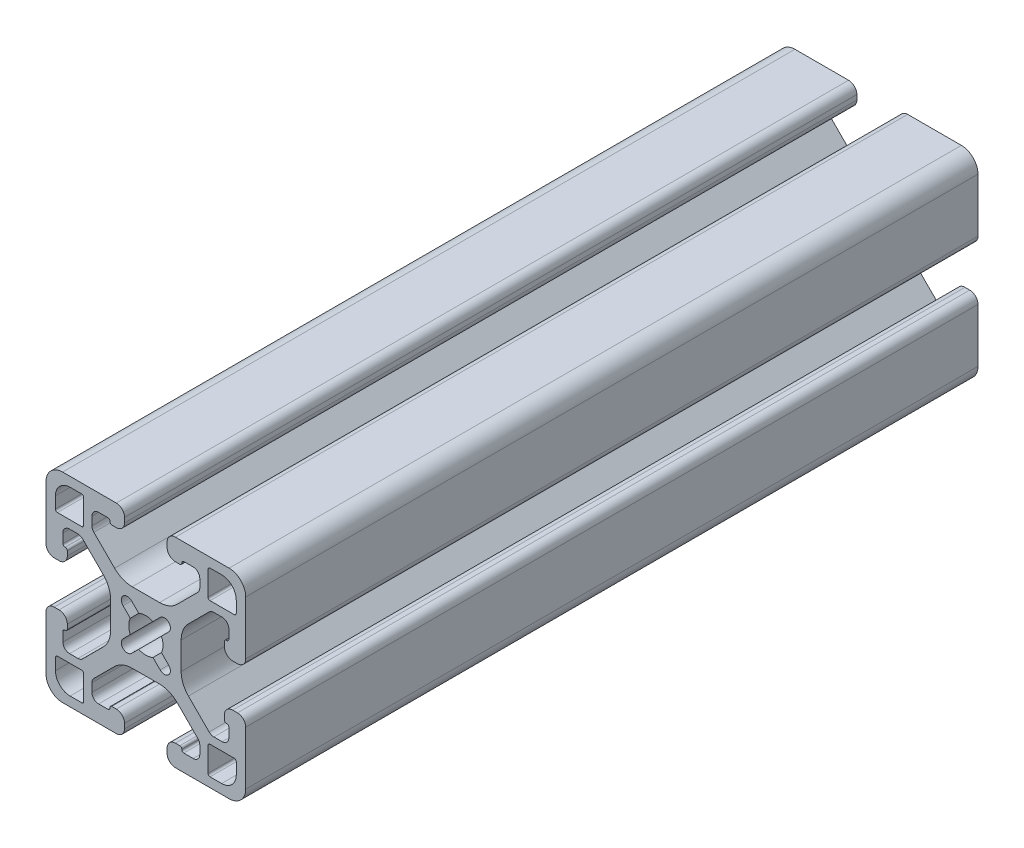
from build123d import *

# Parameters (mm, degrees)
EXTRUDE1_DEPTH = 139.7


with BuildPart() as part:
    # Sketch1 → Extrude1 (new body)
    with BuildSketch(Plane.XY):
        with BuildLine():
            Line((-46.536752228, -7.000622168), (-46.536752228, -8.774580164))
            ThreePointArc((-46.536752228, -8.774580164), (-46.907290083, -9.675221514), (-47.806745776, -10.048628264))
            Line((-47.806745776, -10.048628264), (-49.392633083, -10.048628264))
            ThreePointArc((-49.392633083, -10.048628264), (-49.878641042, -9.95195527), (-50.290658695, -9.676653876))
            Line((-50.290658695, -9.676653876), (-54.238761565, -5.728551005))
            ThreePointArc((-54.238761565, -5.728551005), (-55.26838878, -4.187604983), (-55.629945776, -2.369935216))
            Line((-55.629945776, -2.369935216), (-55.629945776, 2.846678689))
            ThreePointArc((-55.629945776, 2.846678689), (-55.26838878, 4.664348456), (-54.238761565, 6.205294478))
            Line((-54.238761565, 6.205294478), (-50.290658695, 10.153397348))
            ThreePointArc((-50.290658695, 10.153397348), (-49.878641042, 10.428698742), (-49.392633083, 10.525371736))
            Line((-49.392633083, 10.525371736), (-47.806745776, 10.525371736))
            ThreePointArc((-47.806745776, 10.525371736), (-46.907290079, 10.151964982), (-46.536752228, 9.251323623))
            Line((-46.536752228, 9.251323623), (-46.536752228, 7.47736564))
            ThreePointArc((-46.536752228, 7.47736564), (-46.648344767, 7.207957418), (-46.91775299, 7.096364878))
            Line((-46.91775299, 7.096364878), (-46.993953142, 7.096364878))
            ThreePointArc((-46.993953142, 7.096364878), (-47.263362671, 6.984771032), (-47.374953904, 6.715360422))
            Line((-47.374953904, 6.715360422), (-47.374945776, 5.877156465))
            ThreePointArc((-47.374945776, 5.877156465), (-46.913692136, 4.763614578), (-45.800145776, 4.302371736))
            Line((-45.800145776, 4.302371736), (-44.885745776, 4.302371736))
            ThreePointArc((-44.885745776, 4.302371736), (-43.772194017, 4.763619977), (-43.310945776, 5.877171736))
            Line((-43.310945776, 5.877171736), (-43.310945776, 16.113371736))
            ThreePointArc((-43.310945776, 16.113371736), (-44.240881746, 18.358435766), (-46.485945776, 19.288371736))
            Line((-46.485945776, 19.288371736), (-56.722145776, 19.288371736))
            ThreePointArc((-56.722145776, 19.288371736), (-57.835697535, 18.827123495), (-58.296945776, 17.713571736))
            Line((-58.296945776, 17.713571736), (-58.296945776, 16.799171736))
            ThreePointArc((-58.296945776, 16.799171736), (-57.835702934, 15.685625376), (-56.722161047, 15.224371736))
            Line((-56.722161047, 15.224371736), (-55.883957091, 15.224363608))
            ThreePointArc((-55.883957091, 15.224363608), (-55.61454648, 15.335954841), (-55.502952634, 15.60536437))
            Line((-55.502952634, 15.60536437), (-55.502952634, 15.681564523))
            ThreePointArc((-55.502952634, 15.681564523), (-55.391360095, 15.950972745), (-55.121951872, 16.062565285))
            Line((-55.121951872, 16.062565285), (-53.347993876, 16.062565285))
            ThreePointArc((-53.347993876, 16.062565285), (-52.447352526, 15.692027429), (-52.073945776, 14.792571736))
            Line((-52.073945776, 14.792571736), (-52.073945776, 13.206684429))
            ThreePointArc((-52.073945776, 13.206684429), (-52.17061877, 12.72067647), (-52.445920164, 12.308658817))
            Line((-52.445920164, 12.308658817), (-56.394023034, 8.360555947))
            ThreePointArc((-56.394023034, 8.360555947), (-57.934969057, 7.330928733), (-59.752638824, 6.969371736))
            Line((-59.752638824, 6.969371736), (-64.969252728, 6.969371736))
            ThreePointArc((-64.969252728, 6.969371736), (-66.786922496, 7.330928733), (-68.327868518, 8.360555947))
            Line((-68.327868518, 8.360555947), (-72.275971388, 12.308658817))
            ThreePointArc((-72.275971388, 12.308658817), (-72.551272782, 12.72067647), (-72.647945776, 13.206684429))
            Line((-72.647945776, 13.206684429), (-72.647945776, 14.792571736))
            ThreePointArc((-72.647945776, 14.792571736), (-72.274539022, 15.692027434), (-71.373897663, 16.062565285))
            Line((-71.373897663, 16.062565285), (-69.59993968, 16.062565285))
            ThreePointArc((-69.59993968, 16.062565285), (-69.330531458, 15.950972745), (-69.218938918, 15.681564523))
            Line((-69.218938918, 15.681564523), (-69.218938918, 15.60536437))
            ThreePointArc((-69.218938918, 15.60536437), (-69.107345072, 15.335954841), (-68.837934461, 15.224363608))
            Line((-68.837934461, 15.224363608), (-67.999730505, 15.224371736))
            ThreePointArc((-67.999730505, 15.224371736), (-66.886188618, 15.685625376), (-66.424945776, 16.799171736))
            Line((-66.424945776, 16.799171736), (-66.424945776, 17.713571736))
            ThreePointArc((-66.424945776, 17.713571736), (-66.886194017, 18.827123495), (-67.999745776, 19.288371736))
            Line((-67.999745776, 19.288371736), (-78.235945776, 19.288371736))
            ThreePointArc((-78.235945776, 19.288371736), (-80.481009806, 18.358435766), (-81.410945776, 16.113371736))
            Line((-81.410945776, 16.113371736), (-81.410945776, 5.877171736))
            ThreePointArc((-81.410945776, 5.877171736), (-80.949697535, 4.763619977), (-79.836145776, 4.302371736))
            Line((-79.836145776, 4.302371736), (-78.921745776, 4.302371736))
            ThreePointArc((-78.921745776, 4.302371736), (-77.808199416, 4.763614578), (-77.346945776, 5.877156465))
            Line((-77.346945776, 5.877156465), (-77.346937648, 6.715360422))
            ThreePointArc((-77.346937648, 6.715360422), (-77.458528881, 6.984771032), (-77.72793841, 7.096364878))
            Line((-77.72793841, 7.096364878), (-77.804138562, 7.096364878))
            ThreePointArc((-77.804138562, 7.096364878), (-78.073546785, 7.207957418), (-78.185139324, 7.47736564))
            Line((-78.185139324, 7.47736564), (-78.185139324, 9.251323637))
            ThreePointArc((-78.185139324, 9.251323637), (-77.814601469, 10.151964987), (-76.915145776, 10.525371736))
            Line((-76.915145776, 10.525371736), (-75.329258469, 10.525371736))
            ThreePointArc((-75.329258469, 10.525371736), (-74.84325051, 10.428698742), (-74.431232857, 10.153397348))
            Line((-74.431232857, 10.153397348), (-70.483129987, 6.205294478))
            ThreePointArc((-70.483129987, 6.205294478), (-69.453502773, 4.664348456), (-69.091945776, 2.846678689))
            Line((-69.091945776, 2.846678689), (-69.091945776, -2.369935216))
            ThreePointArc((-69.091945776, -2.369935216), (-69.453502773, -4.187604983), (-70.483129987, -5.728551005))
            Line((-70.483129987, -5.728551005), (-74.431232857, -9.676653876))
            ThreePointArc((-74.431232857, -9.676653876), (-74.84325051, -9.95195527), (-75.329258469, -10.048628264))
            Line((-75.329258469, -10.048628264), (-76.915145776, -10.048628264))
            ThreePointArc((-76.915145776, -10.048628264), (-77.814601474, -9.67522151), (-78.185139324, -8.774580151))
            Line((-78.185139324, -8.774580151), (-78.185139324, -7.000622168))
            ThreePointArc((-78.185139324, -7.000622168), (-78.073546785, -6.731213945), (-77.804138562, -6.619621406))
            Line((-77.804138562, -6.619621406), (-77.72793841, -6.619621406))
            ThreePointArc((-77.72793841, -6.619621406), (-77.458528881, -6.50802756), (-77.346937648, -6.238616949))
            Line((-77.346937648, -6.238616949), (-77.346945776, -5.400412993))
            ThreePointArc((-77.346945776, -5.400412993), (-77.808199416, -4.286871106), (-78.921745776, -3.825628264))
            Line((-78.921745776, -3.825628264), (-79.836145776, -3.825628264))
            ThreePointArc((-79.836145776, -3.825628264), (-80.949697535, -4.286876505), (-81.410945776, -5.400428264))
            Line((-81.410945776, -5.400428264), (-81.410945776, -15.636628264))
            ThreePointArc((-81.410945776, -15.636628264), (-80.481009806, -17.881692294), (-78.235945776, -18.811628264))
            Line((-78.235945776, -18.811628264), (-67.999745776, -18.811628264))
            ThreePointArc((-67.999745776, -18.811628264), (-66.886194017, -18.350380023), (-66.424945776, -17.236828264))
            Line((-66.424945776, -17.236828264), (-66.424945776, -16.322428264))
            ThreePointArc((-66.424945776, -16.322428264), (-66.886188618, -15.208881904), (-67.999730505, -14.747628264))
            Line((-67.999730505, -14.747628264), (-68.837934461, -14.747620136))
            ThreePointArc((-68.837934461, -14.747620136), (-69.107345072, -14.859211369), (-69.218938918, -15.128620898))
            Line((-69.218938918, -15.128620898), (-69.218938918, -15.20482105))
            ThreePointArc((-69.218938918, -15.20482105), (-69.330531458, -15.474229273), (-69.59993968, -15.585821812))
            Line((-69.59993968, -15.585821812), (-71.373897676, -15.585821812))
            ThreePointArc((-71.373897676, -15.585821812), (-72.274539027, -15.215283957), (-72.647945776, -14.315828264))
            Line((-72.647945776, -14.315828264), (-72.647945776, -12.729940957))
            ThreePointArc((-72.647945776, -12.729940957), (-72.551272782, -12.243932998), (-72.275971388, -11.831915345))
            Line((-72.275971388, -11.831915345), (-68.327868518, -7.883812475))
            ThreePointArc((-68.327868518, -7.883812475), (-66.786922496, -6.85418526), (-64.969252728, -6.492628264))
            Line((-64.969252728, -6.492628264), (-59.752638824, -6.492628264))
            ThreePointArc((-59.752638824, -6.492628264), (-57.934969057, -6.85418526), (-56.394023034, -7.883812475))
            Line((-56.394023034, -7.883812475), (-52.445920164, -11.831915345))
            ThreePointArc((-52.445920164, -11.831915345), (-52.17061877, -12.243932998), (-52.073945776, -12.729940957))
            Line((-52.073945776, -12.729940957), (-52.073945776, -14.315828264))
            ThreePointArc((-52.073945776, -14.315828264), (-52.44735253, -15.215283961), (-53.347993889, -15.585821812))
            Line((-53.347993889, -15.585821812), (-55.121951872, -15.585821812))
            ThreePointArc((-55.121951872, -15.585821812), (-55.391360095, -15.474229273), (-55.502952634, -15.20482105))
            Line((-55.502952634, -15.20482105), (-55.502952634, -15.128620898))
            ThreePointArc((-55.502952634, -15.128620898), (-55.61454648, -14.859211369), (-55.883957091, -14.747620136))
            Line((-55.883957091, -14.747620136), (-56.722161047, -14.747628264))
            ThreePointArc((-56.722161047, -14.747628264), (-57.835702934, -15.208881904), (-58.296945776, -16.322428264))
            Line((-58.296945776, -16.322428264), (-58.296945776, -17.236828264))
            ThreePointArc((-58.296945776, -17.236828264), (-57.835697535, -18.350380023), (-56.722145776, -18.811628264))
            Line((-56.722145776, -18.811628264), (-46.485945776, -18.811628264))
            ThreePointArc((-46.485945776, -18.811628264), (-44.240881746, -17.881692294), (-43.310945776, -15.636628264))
            Line((-43.310945776, -15.636628264), (-43.310945776, -5.400428264))
            ThreePointArc((-43.310945776, -5.400428264), (-43.772194017, -4.286876505), (-44.885745776, -3.825628264))
            Line((-44.885745776, -3.825628264), (-45.800145776, -3.825628264))
            ThreePointArc((-45.800145776, -3.825628264), (-46.913692136, -4.286871106), (-47.374945776, -5.400412993))
            Line((-47.374945776, -5.400412993), (-47.374953904, -6.238616949))
            ThreePointArc((-47.374953904, -6.238616949), (-47.263362671, -6.50802756), (-46.993953142, -6.619621406))
            Line((-46.993953142, -6.619621406), (-46.91775299, -6.619621406))
            ThreePointArc((-46.91775299, -6.619621406), (-46.648344767, -6.731213945), (-46.536752228, -7.000622168))
        make_face()
        with BuildLine():
            Line((-66.704246649, -2.488483035), (-65.333825803, -1.118062189))
            ThreePointArc((-65.333825803, -1.118062189), (-65.628655776, 0.238371736), (-65.333825803, 1.594805661))
            Line((-65.333825803, 1.594805661), (-66.704246649, 2.965226507))
            ThreePointArc((-66.704246649, 2.965226507), (-66.704246649, 4.581672609), (-65.087800547, 4.581672609))
            Line((-65.087800547, 4.581672609), (-63.717379701, 3.211251763))
            ThreePointArc((-63.717379701, 3.211251763), (-62.360945776, 3.506081736), (-61.004511851, 3.211251763))
            Line((-61.004511851, 3.211251763), (-59.721184579, 4.483982556))
            ThreePointArc((-59.721184579, 4.483982556), (-58.017644903, 4.581672609), (-58.115334956, 2.878132934))
            Line((-58.115334956, 2.878132934), (-59.38806575, 1.594805661))
            ThreePointArc((-59.38806575, 1.594805661), (-59.093235776, 0.238371736), (-59.38806575, -1.118062189))
            Line((-59.38806575, -1.118062189), (-58.017644903, -2.488483035))
            ThreePointArc((-58.017644903, -2.488483035), (-58.017644903, -4.104929137), (-59.634091005, -4.104929137))
            Line((-59.634091005, -4.104929137), (-61.004511851, -2.73450829))
            ThreePointArc((-61.004511851, -2.73450829), (-62.360945776, -3.029338264), (-63.717379701, -2.73450829))
            Line((-63.717379701, -2.73450829), (-65.087800547, -4.104929137))
            ThreePointArc((-65.087800547, -4.104929137), (-66.704246649, -4.104929137), (-66.704246649, -2.488483035))
        make_face(mode=Mode.SUBTRACT)
        with BuildLine():
            Line((-79.607545776, 12.481171736), (-79.607545776, 14.690971736))
            ThreePointArc((-79.607545776, 14.690971736), (-78.789202123, 16.666628083), (-76.813545776, 17.484971736))
            Line((-76.813545776, 17.484971736), (-74.603745776, 17.484971736))
            ThreePointArc((-74.603745776, 17.484971736), (-74.334338092, 17.37337942), (-74.222745776, 17.103971736))
            Line((-74.222745776, 17.103971736), (-74.222745776, 12.481171736))
            ThreePointArc((-74.222745776, 12.481171736), (-74.334338092, 12.211764053), (-74.603745776, 12.100171736))
            Line((-74.603745776, 12.100171736), (-79.226545776, 12.100171736))
            ThreePointArc((-79.226545776, 12.100171736), (-79.49595346, 12.211764053), (-79.607545776, 12.481171736))
        make_face(mode=Mode.SUBTRACT)
        with BuildLine():
            Line((-74.603745776, -17.008228264), (-76.813545776, -17.008228264))
            ThreePointArc((-76.813545776, -17.008228264), (-78.789202123, -16.18988461), (-79.607545776, -14.214228264))
            Line((-79.607545776, -14.214228264), (-79.607545776, -12.004428264))
            ThreePointArc((-79.607545776, -12.004428264), (-79.49595346, -11.73502058), (-79.226545776, -11.623428264))
            Line((-79.226545776, -11.623428264), (-74.603745776, -11.623428264))
            ThreePointArc((-74.603745776, -11.623428264), (-74.334338092, -11.73502058), (-74.222745776, -12.004428264))
            Line((-74.222745776, -12.004428264), (-74.222745776, -16.627228264))
            ThreePointArc((-74.222745776, -16.627228264), (-74.334338092, -16.896635947), (-74.603745776, -17.008228264))
        make_face(mode=Mode.SUBTRACT)
        with BuildLine():
            Line((-45.114345776, -12.004428264), (-45.114345776, -14.214228264))
            ThreePointArc((-45.114345776, -14.214228264), (-45.932689429, -16.18988461), (-47.908345776, -17.008228264))
            Line((-47.908345776, -17.008228264), (-50.118145776, -17.008228264))
            ThreePointArc((-50.118145776, -17.008228264), (-50.38755346, -16.896635947), (-50.499145776, -16.627228264))
            Line((-50.499145776, -16.627228264), (-50.499145776, -12.004428264))
            ThreePointArc((-50.499145776, -12.004428264), (-50.38755346, -11.73502058), (-50.118145776, -11.623428264))
            Line((-50.118145776, -11.623428264), (-45.495345776, -11.623428264))
            ThreePointArc((-45.495345776, -11.623428264), (-45.225938092, -11.73502058), (-45.114345776, -12.004428264))
        make_face(mode=Mode.SUBTRACT)
        with BuildLine():
            Line((-50.118145776, 17.484971736), (-47.908345776, 17.484971736))
            ThreePointArc((-47.908345776, 17.484971736), (-45.932689429, 16.666628083), (-45.114345776, 14.690971736))
            Line((-45.114345776, 14.690971736), (-45.114345776, 12.481171736))
            ThreePointArc((-45.114345776, 12.481171736), (-45.225938092, 12.211764053), (-45.495345776, 12.100171736))
            Line((-45.495345776, 12.100171736), (-50.118145776, 12.100171736))
            ThreePointArc((-50.118145776, 12.100171736), (-50.38755346, 12.211764053), (-50.499145776, 12.481171736))
            Line((-50.499145776, 12.481171736), (-50.499145776, 17.103971736))
            ThreePointArc((-50.499145776, 17.103971736), (-50.38755346, 17.37337942), (-50.118145776, 17.484971736))
        make_face(mode=Mode.SUBTRACT)
    extrude(amount=-EXTRUDE1_DEPTH)


solid = part.part
